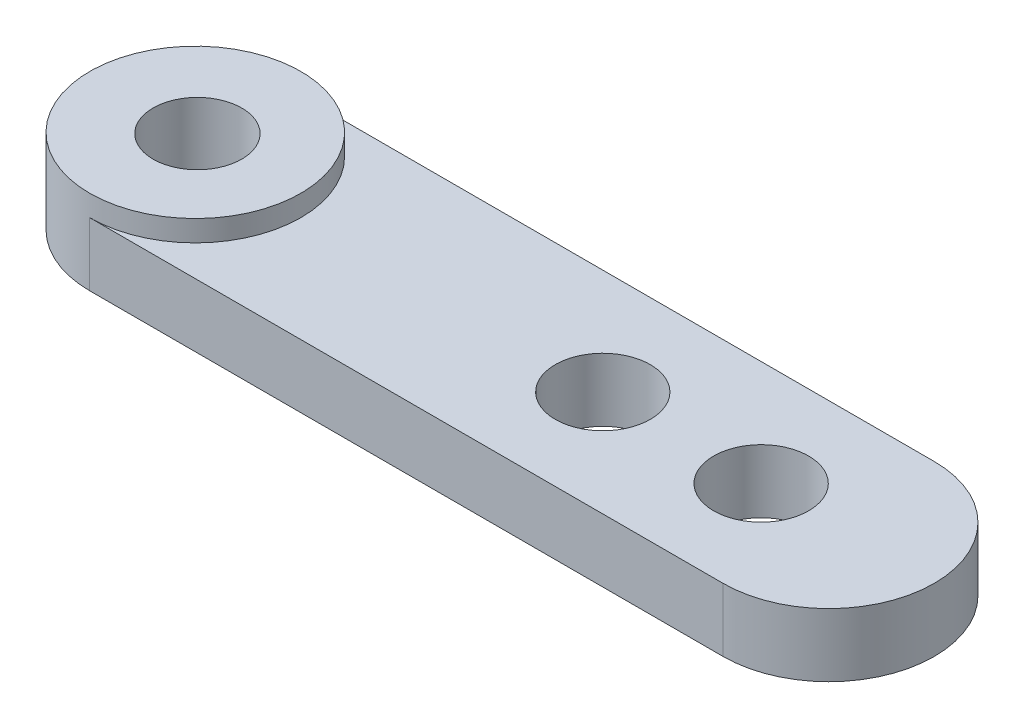
from build123d import *

# Parameters (mm, degrees)
SKETCH1_R           = 2.1
SKETCH1_R_2         = 2.25
BOSS_EXTRUDE1_DEPTH = 3
SKETCH3_R           = 5
SKETCH3_R_2         = 2.1
BOSS_EXTRUDE3_DEPTH = 1


with BuildPart() as part:
    # Sketch1 → Boss-Extrude1 (new body)
    with BuildSketch(Plane(origin=(0, 0, 0), x_dir=(1, 0, 0), z_dir=(0, 1, 0))):
        with BuildLine():
            Line((0, 5), (30, 5))
            ThreePointArc((30, 5), (35, 0), (30, -5))
            Line((30, -5), (0, -5))
            ThreePointArc((0, -5), (-5, 0), (0, 5))
        make_face()
        with Locations(Location((0.1, 0, 0), (0, 0, 270))):
            Circle(SKETCH1_R, mode=Mode.SUBTRACT)
        with Locations(Location((19.3, 0, 0), (0, 0, 270))):
            Circle(SKETCH1_R_2, mode=Mode.SUBTRACT)
        with Locations(Location((26.8, 0, 0), (0, 0, 270))):
            Circle(SKETCH1_R_2, mode=Mode.SUBTRACT)
    extrude(amount=BOSS_EXTRUDE1_DEPTH)

    # Sketch3 → Boss-Extrude3 (add)
    with BuildSketch(Plane(origin=(0, 3, 0), x_dir=(1, 0, 0), z_dir=(0, 1, 0))):
        with Locations(Location((0, 0, 0), (0, 0, 270))):
            Circle(SKETCH3_R)
        with Locations(Location((0.1, 0, 0), (0, 0, 270))):
            Circle(SKETCH3_R_2, mode=Mode.SUBTRACT)
    extrude(amount=BOSS_EXTRUDE3_DEPTH)


solid = part.part
